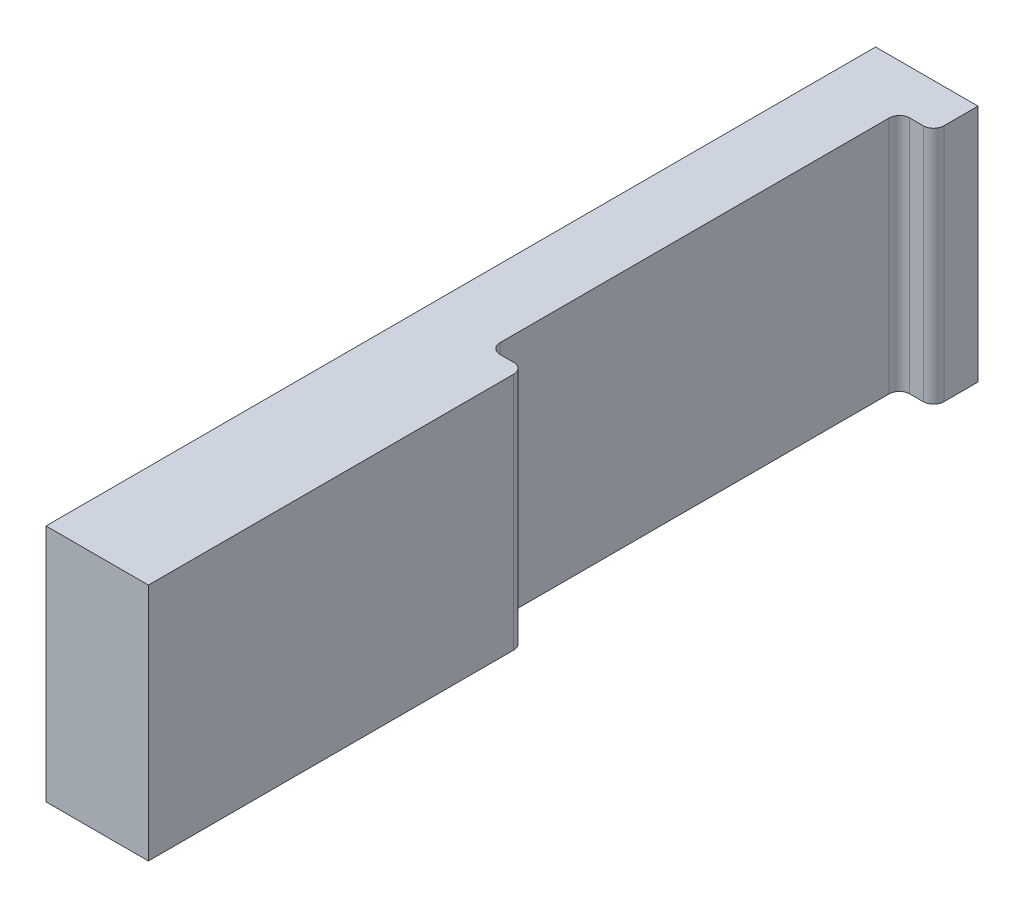
from build123d import *

# Parameters (mm, degrees)
SKETCH1_W           = 30
SKETCH1_H           = 243
BOSS_EXTRUDE1_DEPTH = 70
SKETCH2_W           = 10
SKETCH2_H           = 120
CUT_EXTRUDE1_DEPTH  = 70
SKETCH3_R           = 3
CUT_EXTRUDE2_DEPTH  = 20
FILLET4_R           = 3
SKETCH4_R           = 4.910397135
BOSS_EXTRUDE2_DEPTH = 70
SKETCH5_R           = 5.150538885
BOSS_EXTRUDE3_DEPTH = 20
SKETCH6_R           = 1.5
CUT_EXTRUDE4_DEPTH  = 20


with BuildPart() as part:
    # Sketch1 → Boss-Extrude1 (new body)
    with BuildSketch(Plane(origin=(0, 0, 0), x_dir=(1, 0, 0), z_dir=(0, 1, 0))):
        with Locations((24.763584202, -32.998984966)):
            Rectangle(SKETCH1_W, SKETCH1_H)
    extrude(amount=BOSS_EXTRUDE1_DEPTH)

    # Sketch2 → Cut-Extrude1 (cut)
    with BuildSketch(Plane(origin=(0, 70, 0), x_dir=(1, 0, 0), z_dir=(0, 1, 0))):
        with Locations((34.763584202, 15.501015034)):
            Rectangle(SKETCH2_W, SKETCH2_H)
    extrude(amount=-CUT_EXTRUDE1_DEPTH, mode=Mode.SUBTRACT)

    # Sketch3 → Cut-Extrude2 (cut)
    with BuildSketch(Plane(origin=(0, 0, 0), x_dir=(-1, 0, 0), z_dir=(0, -1, 0))):
        with Locations(Location((-29.763584202, -124.498984966, 0), (0, 0, 90))):
            Circle(SKETCH3_R)
        with Locations(Location((-19.763584202, 10.131015034, 0), (0, 0, 90))):
            Circle(SKETCH3_R)
    extrude(amount=-CUT_EXTRUDE2_DEPTH, mode=Mode.SUBTRACT)

    # Fillet4
    fillet4_edges = [part.edges().sort_by_distance(p)[0] for p in [
        (39.763584202, 35, -75.501015034),
        (39.763584202, 35, 44.498984966),
        (29.763584202, 35, 44.498984966),
        (29.763584202, 35, -75.501015034),
    ]]
    fillet(fillet4_edges, radius=FILLET4_R)

    # Sketch4 → Boss-Extrude2 (add)
    with BuildSketch(Plane(origin=(0, 70, 0), x_dir=(1, 0, 0), z_dir=(0, 1, 0))):
        with Locations((29.763584202, -124.498984966)):
            Circle(SKETCH4_R)
    extrude(amount=-BOSS_EXTRUDE2_DEPTH)

    # Sketch5 → Boss-Extrude3 (add)
    with BuildSketch(Plane(origin=(0, 20, 0), x_dir=(-1, 0, 0), z_dir=(0, -1, 0))):
        with Locations((-18.41994484, 11.101990407)):
            Circle(SKETCH5_R)
    extrude(amount=BOSS_EXTRUDE3_DEPTH)

    # Sketch6 → Cut-Extrude4 (cut)
    with BuildSketch(Plane(origin=(0, 0, 0), x_dir=(-1, 0, 0), z_dir=(0, -1, 0))):
        with Locations(Location((-19.763584202, 10.131015034, 0), (0, 0, 90))):
            Circle(SKETCH6_R)
        with Locations(Location((-29.763584202, -124.498984966, 0), (0, 0, 90))):
            Circle(SKETCH6_R)
    extrude(amount=-CUT_EXTRUDE4_DEPTH, mode=Mode.SUBTRACT)


solid = part.part
